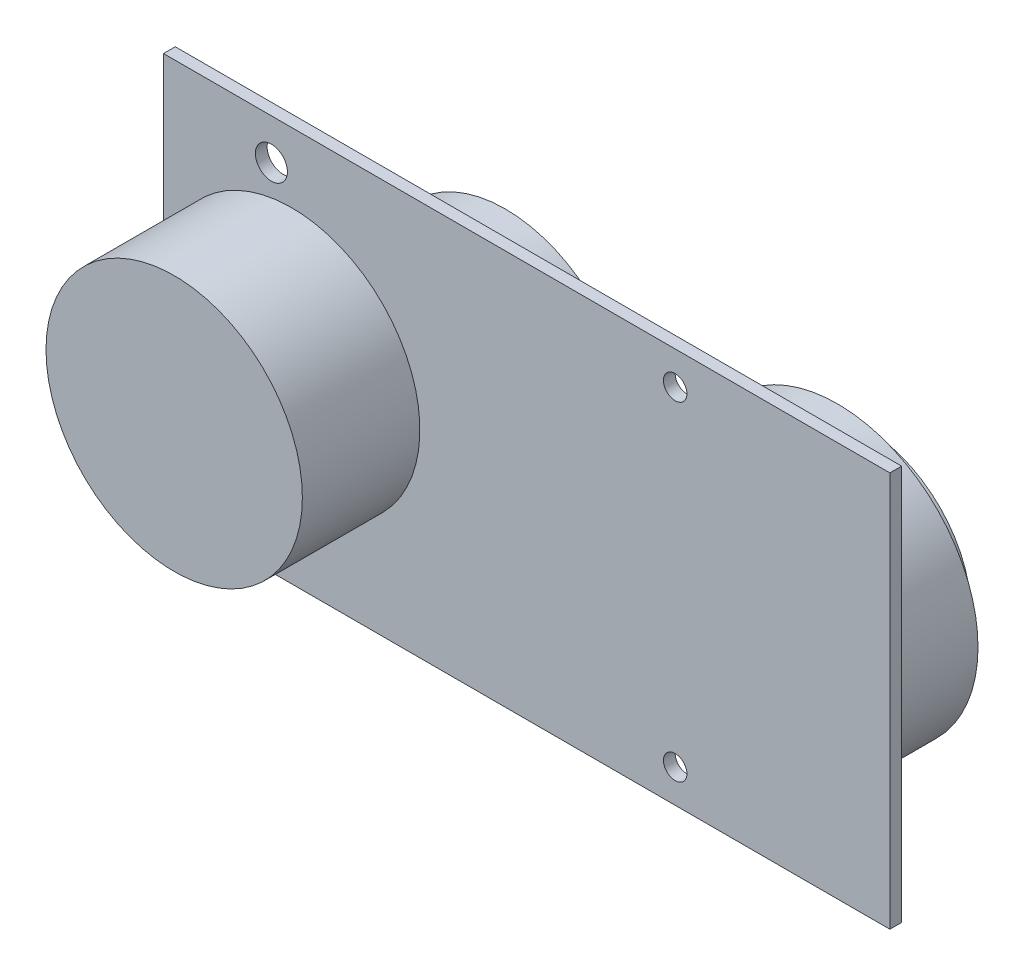
from build123d import *

# Parameters (mm, degrees)
SKETCH_1_R          = 12
EXTRUDE_1_DEPTH     = 11
EXTRUDE_START       = -11
SKETCH_2_R          = 3
EXTRUDE_2_DEPTH     = 20
SKETCH_3_W          = 68
SKETCH_3_H          = 37
EXTRUDE_3_DEPTH     = 1.1
SKETCH_3_3_R        = 13.15
EXTRUDE_4_DEPTH     = 11
CUT_EXTRUDE_START   = -2.5
SKETCH_5_R          = 13.15
SKETCH_5_R_2        = 10
CUT_EXTRUDE_2_DEPTH = 2.5
EXTRUDE_START_2     = -1.1
SKETCH_6_R          = 11.8
EXTRUDE_5_DEPTH     = 6.5
SKETCH_6_3_R        = 13.5
EXTRUDE_6_DEPTH     = 4.2
SKETCH_6_4_R        = 3.05
EXTRUDE_7_DEPTH     = 8.8
SKETCH_4_R          = 1.5
SKETCH_4_R_2        = 1.1
CUT_EXTRUDE_1_DEPTH = 61.205149281
SKETCH_7_R          = 1.25
CUT_EXTRUDE_3_DEPTH = 2.5


with BuildPart() as part:
    # 草图1 → 凸台-拉伸1 (new body)
    with BuildSketch(Plane.XY):
        Circle(SKETCH_1_R)
    extrude(amount=EXTRUDE_1_DEPTH)

    # 草图2 → 凸台-拉伸2 (add)
    with BuildSketch(Plane(origin=(0, 0, 0), x_dir=(-1, 0, 0), z_dir=(0, 0, -1)).offset(EXTRUDE_START)):
        with Locations(Location((0, 0, 0), (0, 0, 180))):
            Circle(SKETCH_2_R)
    extrude(amount=EXTRUDE_2_DEPTH)

    # 草图3 → 凸台-拉伸3 (add)
    with BuildSketch(Plane.XY):
        with Locations((22, 0)):
            Rectangle(SKETCH_3_W, SKETCH_3_H)
    extrude(amount=-EXTRUDE_3_DEPTH)

    # 草图3<3> → 凸台-拉伸4 (add)
    with BuildSketch(Plane.XY):
        with Locations((42.6, 0)):
            Circle(SKETCH_3_3_R)
    extrude(amount=-EXTRUDE_4_DEPTH)

    # 草图5 → 切除-拉伸2 (cut)
    with BuildSketch(Plane(origin=(0, 0, -11), x_dir=(-1, 0, 0), z_dir=(0, 0, -1)).offset(CUT_EXTRUDE_START)):
        with Locations(Location((-42.6, 0, 0), (0, 0, 180))):
            Circle(SKETCH_5_R)
        with Locations((-42.6, 0)):
            Circle(SKETCH_5_R_2, mode=Mode.SUBTRACT)
    extrude(amount=CUT_EXTRUDE_2_DEPTH, mode=Mode.SUBTRACT)

    # 草图6 → 凸台-拉伸5 (add)
    with BuildSketch(Plane(origin=(0, 0, -1.1), x_dir=(-1, 0, 0), z_dir=(0, 0, -1)).offset(EXTRUDE_START_2)):
        with Locations((-13.5, 3.6)):
            Circle(SKETCH_6_R)
    extrude(amount=EXTRUDE_5_DEPTH)

    # 草图6<3> → 凸台-拉伸6 (add)
    with BuildSketch(Plane(origin=(0, 0, -1.1), x_dir=(-1, 0, 0), z_dir=(0, 0, -1)).offset(EXTRUDE_START_2)):
        with Locations((-26.7, -2.2)):
            Circle(SKETCH_6_3_R)
    extrude(amount=EXTRUDE_6_DEPTH)

    # 草图6<4> → 凸台-拉伸7 (add)
    with BuildSketch(Plane(origin=(0, 0, -1.1), x_dir=(-1, 0, 0), z_dir=(0, 0, -1)).offset(EXTRUDE_START_2)):
        with Locations(Location((-26.7, -2.2, 0), (0, 0, 180))):
            Circle(SKETCH_6_4_R)
    extrude(amount=EXTRUDE_7_DEPTH)

    # 草图4 → 切除-拉伸1 (cut, through all)
    with BuildSketch(Plane(origin=(0, 0, -1.1), x_dir=(-1, 0, 0), z_dir=(0, 0, -1))):
        with Locations((1.9, 14.7)):
            Circle(SKETCH_4_R)
        with Locations((1.9, -14.7)):
            Circle(SKETCH_4_R)
        with Locations((-35.9, 15.4)):
            Circle(SKETCH_4_R_2)
        with Locations((-35.9, -15.4)):
            Circle(SKETCH_4_R_2)
    extrude(amount=-CUT_EXTRUDE_1_DEPTH, mode=Mode.SUBTRACT)

    # 草图7 → 切除-拉伸3 (cut)
    with BuildSketch(Plane(origin=(0, 0, -11), x_dir=(-1, 0, 0), z_dir=(0, 0, -1))):
        with Locations((-48.85, 0)):
            Circle(SKETCH_7_R)
        with Locations((-36.35, 0)):
            Circle(SKETCH_7_R)
    extrude(amount=-CUT_EXTRUDE_3_DEPTH, mode=Mode.SUBTRACT)


solid = part.part
